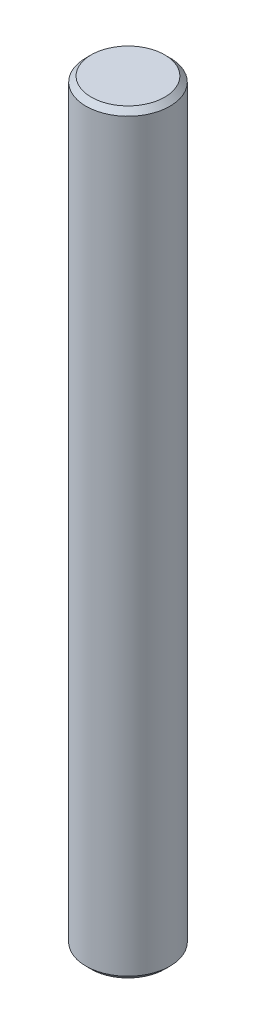
from build123d import *

# Parameters (mm, degrees)
SKETCH1_R           = 4
BOSS_EXTRUDE1_DEPTH = 36
CHAMFER1_SIZE       = 0.5


with BuildPart() as part:
    # Sketch1 → Boss-Extrude1 (new, symmetric)
    with BuildSketch(Plane(origin=(0, 0, 0), x_dir=(1, 0, 0), z_dir=(0, 1, 0))):
        with Locations(Location((0, 0, 0), (0, 0, 270))):
            Circle(SKETCH1_R)
    extrude(amount=BOSS_EXTRUDE1_DEPTH, both=True)

    # Chamfer1
    chamfer1_edges = [part.edges().sort_by_distance(p)[0] for p in [
        (0, -36, -4),
        (0, 36, -4),
    ]]
    chamfer(chamfer1_edges, length=CHAMFER1_SIZE)


solid = part.part
